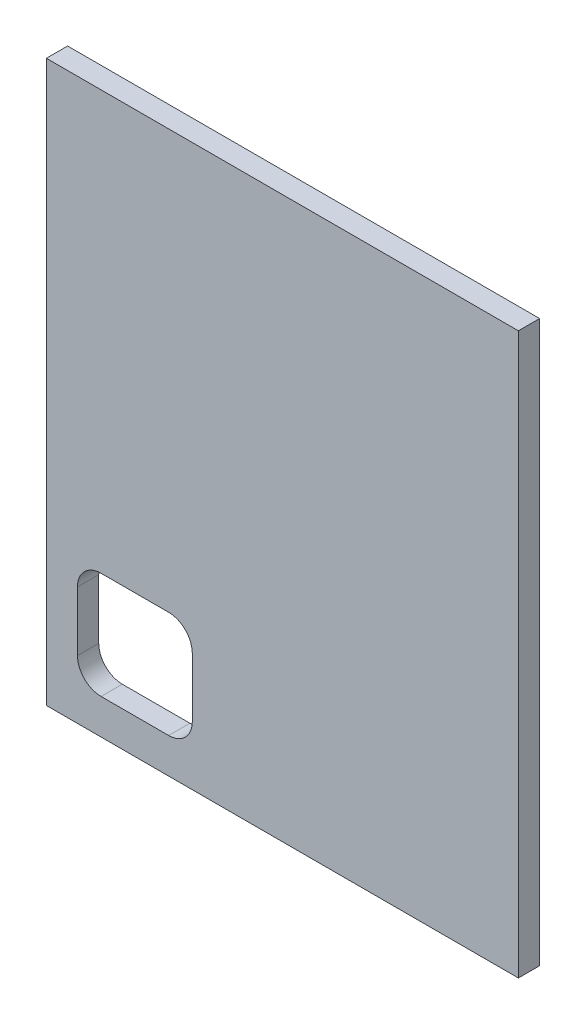
from build123d import *

# Parameters (mm, degrees)
SKETCH1_W      = 50.8
SKETCH1_H      = 60.325
EXTRUDE2_DEPTH = 2.286


with BuildPart() as part:
    # Sketch1 → Extrude2 (new body)
    with BuildSketch(Plane.XY):
        with Locations((25.4, 30.1625)):
            Rectangle(SKETCH1_W, SKETCH1_H)
        with BuildLine():
            Line((5.886865084, 15.264808366), (13.163134916, 15.264808366))
            ThreePointArc((13.163134916, 15.264808366), (14.95918614, 14.52085959), (15.703134916, 12.724808366))
            Line((15.703134916, 12.724808366), (15.703134916, 6.325191634))
            ThreePointArc((15.703134916, 6.325191634), (14.95918614, 4.52914041), (13.163134916, 3.785191634))
            Line((13.163134916, 3.785191634), (5.886865084, 3.785191634))
            ThreePointArc((5.886865084, 3.785191634), (4.09081386, 4.52914041), (3.346865084, 6.325191634))
            Line((3.346865084, 6.325191634), (3.346865084, 12.724808366))
            ThreePointArc((3.346865084, 12.724808366), (4.09081386, 14.52085959), (5.886865084, 15.264808366))
        make_face(mode=Mode.SUBTRACT)
    extrude(amount=-EXTRUDE2_DEPTH)


solid = part.part
